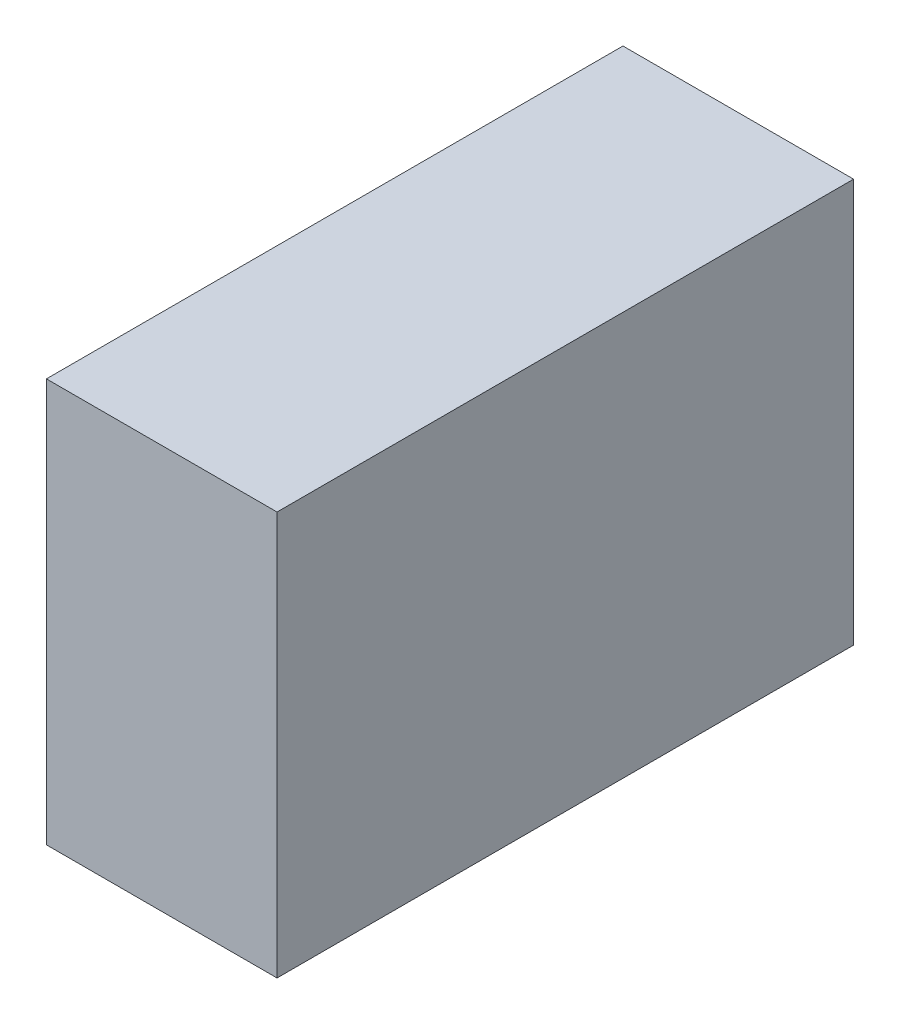
from build123d import *

# Parameters (mm, degrees)
SKETCH1_W           = 20
SKETCH1_H           = 35
BOSS_EXTRUDE1_DEPTH = 50


with BuildPart() as part:
    # Sketch1 → Boss-Extrude1 (new body)
    with BuildSketch(Plane.XY):
        Rectangle(SKETCH1_W, SKETCH1_H)
    extrude(amount=BOSS_EXTRUDE1_DEPTH)


solid = part.part
